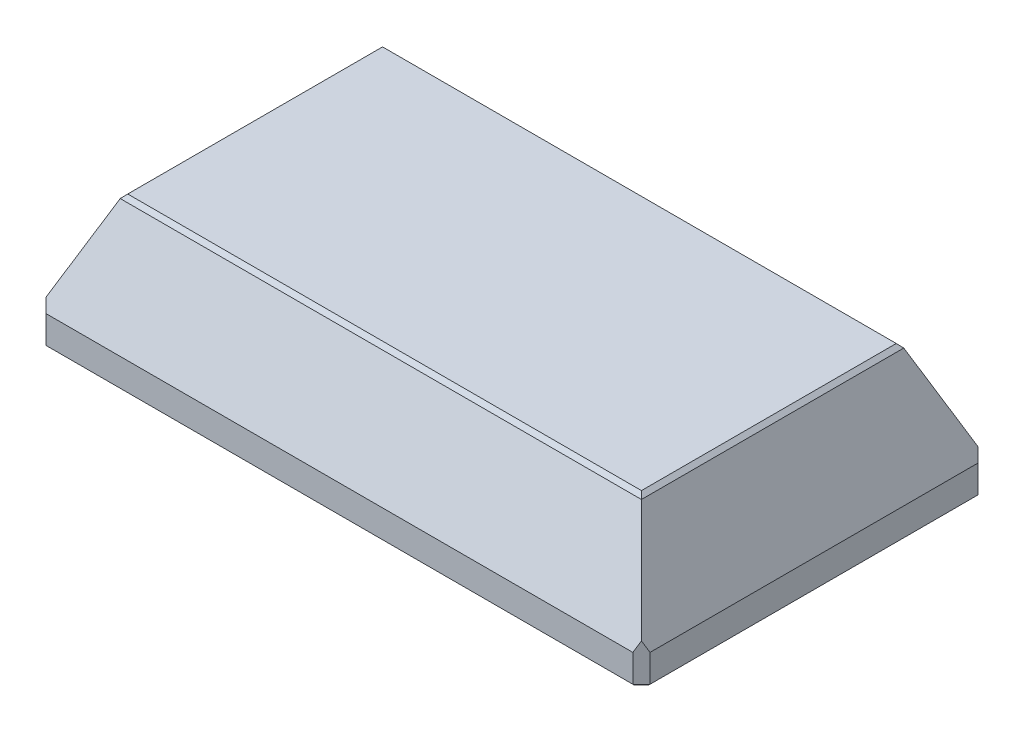
from build123d import *
from OCP.BRepFilletAPI import BRepFilletAPI_MakeChamfer

# Parameters (mm, degrees)
SKETCH1_W           = 140
SKETCH1_H           = 80
BOSS_EXTRUDE1_DEPTH = 7
CHAMFER1_SIZE       = 2
SKETCH4_R           = 2.05
CUT_EXTRUDE1_DEPTH  = 7
SKETCH5_W           = 114
SKETCH5_H           = 50
CUT_EXTRUDE2_DEPTH  = 29
SKETCH6_W           = 114
SKETCH6_H           = 62
CUT_EXTRUDE3_DEPTH  = 25
SKETCH7_W           = 6
SKETCH7_H           = 62
CUT_EXTRUDE4_DEPTH  = 4
SKETCH8_R           = 2.05
CUT_EXTRUDE5_DEPTH  = 6
CHAMFER2_SIZE       = 1
CHAMFER2_SIZE2      = 0.471497246
CHAMFER3_SIZE       = 0.6


with BuildPart() as part:
    # Sketch1 → Boss-Extrude1 (new body)
    with BuildSketch(Plane(origin=(0, 0, 0), x_dir=(1, 0, 0), z_dir=(0, 1, 0))):
        Rectangle(SKETCH1_W, SKETCH1_H)
    extrude(amount=BOSS_EXTRUDE1_DEPTH)

    # Sketch3 → Loft2 section 0
    with BuildSketch(Plane(origin=(0, 7, 0), x_dir=(1, 0, 0), z_dir=(0, 1, 0))):
        with BuildLine():
            Line((70, -40), (70, 40))
            Line((70, 40), (-70, 40))
            Line((-70, 40), (-70, -40))
            Line((-70, -40), (70, -40))
        make_face()
    # Sketch2 → Loft2 section 1
    with BuildSketch(Plane(origin=(0, 30, 0), x_dir=(1, 0, 0), z_dir=(0, 1, 0))):
        with BuildLine():
            Line((-60, -30), (60, -30))
            Line((60, -30), (60, 30))
            Line((60, 30), (-60, 30))
            Line((-60, 30), (-60, -30))
        make_face()
    loft()

    # Chamfer1
    chamfer1_edges = [part.edges().sort_by_distance(p)[0] for p in [
        (-70, 3.5, 40),
        (70, 3.5, 40),
        (70, 3.5, -40),
        (-70, 3.5, -40),
    ]]
    chamfer(chamfer1_edges, length=CHAMFER1_SIZE)

    # Sketch4 → Cut-Extrude1 (cut)
    with BuildSketch(Plane.XZ):
        with Locations(Location((40, -36.5, 0), (0, 0, 270))):
            Circle(SKETCH4_R)
        with Locations(Location((-40, -36.5, 0), (0, 0, 270))):
            Circle(SKETCH4_R)
    cut_extrude1 = extrude(amount=-CUT_EXTRUDE1_DEPTH, mode=Mode.SUBTRACT)

    # Sketch5 → Cut-Extrude2 (cut)
    with BuildSketch(Plane.XZ):
        Rectangle(SKETCH5_W, SKETCH5_H)
    extrude(amount=-CUT_EXTRUDE2_DEPTH, mode=Mode.SUBTRACT)

    # Mirror1: Cut-Extrude1 across plane
    add(cut_extrude1.mirror(Plane.XY), mode=Mode.SUBTRACT)

    # Sketch6 → Cut-Extrude3 (cut)
    with BuildSketch(Plane.XZ):
        Rectangle(SKETCH6_W, SKETCH6_H)
    extrude(amount=-CUT_EXTRUDE3_DEPTH, mode=Mode.SUBTRACT)

    # Sketch7 → Cut-Extrude4 (cut)
    with BuildSketch(Plane.XZ):
        with Locations((-60, 0)):
            Rectangle(SKETCH7_W, SKETCH7_H)
        with Locations((60, 0)):
            Rectangle(SKETCH7_W, SKETCH7_H)
    extrude(amount=-CUT_EXTRUDE4_DEPTH, mode=Mode.SUBTRACT)

    # Sketch8 → Cut-Extrude5 (cut)
    with BuildSketch(Plane.XZ.offset(-4)):
        with Locations(Location((-60, 25, 0), (0, 0, 270))):
            Circle(SKETCH8_R)
        with Locations(Location((-60, -25, 0), (0, 0, 270))):
            Circle(SKETCH8_R)
        with Locations(Location((60, -25, 0), (0, 0, 90))):
            Circle(SKETCH8_R)
        with Locations(Location((60, 25, 0), (0, 0, 90))):
            Circle(SKETCH8_R)
    extrude(amount=-CUT_EXTRUDE5_DEPTH, mode=Mode.SUBTRACT)

    # Chamfer2: one chamfer whose edges measure the first distance from different faces: ONE call of the kernel's chamfer builder (chamfer() names one face for all edges)
    chamfer2_edges_1 = [part.edges().sort_by_distance(p)[0] for p in [
        (60, 30, 0),
    ]]
    chamfer2_side_1 = [part.faces().sort_by_distance(p)[0] for p in [
        (65.225405922, 17.98156638, 0),
    ]]
    chamfer2_edges_2 = [part.edges().sort_by_distance(p)[0] for p in [
        (0, 30, -30),
    ]]
    chamfer2_side_2 = [part.faces().sort_by_distance(p)[0] for p in [
        (0, 18.221212121, -35.121212121),
    ]]
    chamfer2_edges_3 = [part.edges().sort_by_distance(p)[0] for p in [
        (-60, 30, 0),
    ]]
    chamfer2_side_3 = [part.faces().sort_by_distance(p)[0] for p in [
        (-65.225405922, 17.98156638, 0),
    ]]
    chamfer2_edges_4 = [part.edges().sort_by_distance(p)[0] for p in [
        (0, 30, 30),
    ]]
    chamfer2_side_4 = [part.faces().sort_by_distance(p)[0] for p in [
        (0, 18.221212121, 35.121212121),
    ]]
    chamfer2 = BRepFilletAPI_MakeChamfer(part.part.solid().wrapped)
    for e in chamfer2_edges_1:
        chamfer2.Add(CHAMFER2_SIZE, CHAMFER2_SIZE2, e.wrapped, chamfer2_side_1[0].wrapped)  # the first distance lies on this face
    for e in chamfer2_edges_2:
        chamfer2.Add(CHAMFER2_SIZE, CHAMFER2_SIZE2, e.wrapped, chamfer2_side_2[0].wrapped)  # the first distance lies on this face
    for e in chamfer2_edges_3:
        chamfer2.Add(CHAMFER2_SIZE, CHAMFER2_SIZE2, e.wrapped, chamfer2_side_3[0].wrapped)  # the first distance lies on this face
    for e in chamfer2_edges_4:
        chamfer2.Add(CHAMFER2_SIZE, CHAMFER2_SIZE2, e.wrapped, chamfer2_side_4[0].wrapped)  # the first distance lies on this face
    add(Compound.cast(chamfer2.Shape()), mode=Mode.REPLACE)

    # Chamfer3
    chamfer3_edges = [part.edges().sort_by_distance(p)[0] for p in [
        (0, 0, 40),
        (70, 0, 0),
        (-70, 0, 0),
        (0, 0, -40),
        (-69, 0, -39),
        (69, 0, -39),
        (69, 0, 39),
        (-69, 0, 39),
    ]]
    chamfer(chamfer3_edges, length=CHAMFER3_SIZE)


solid = part.part
